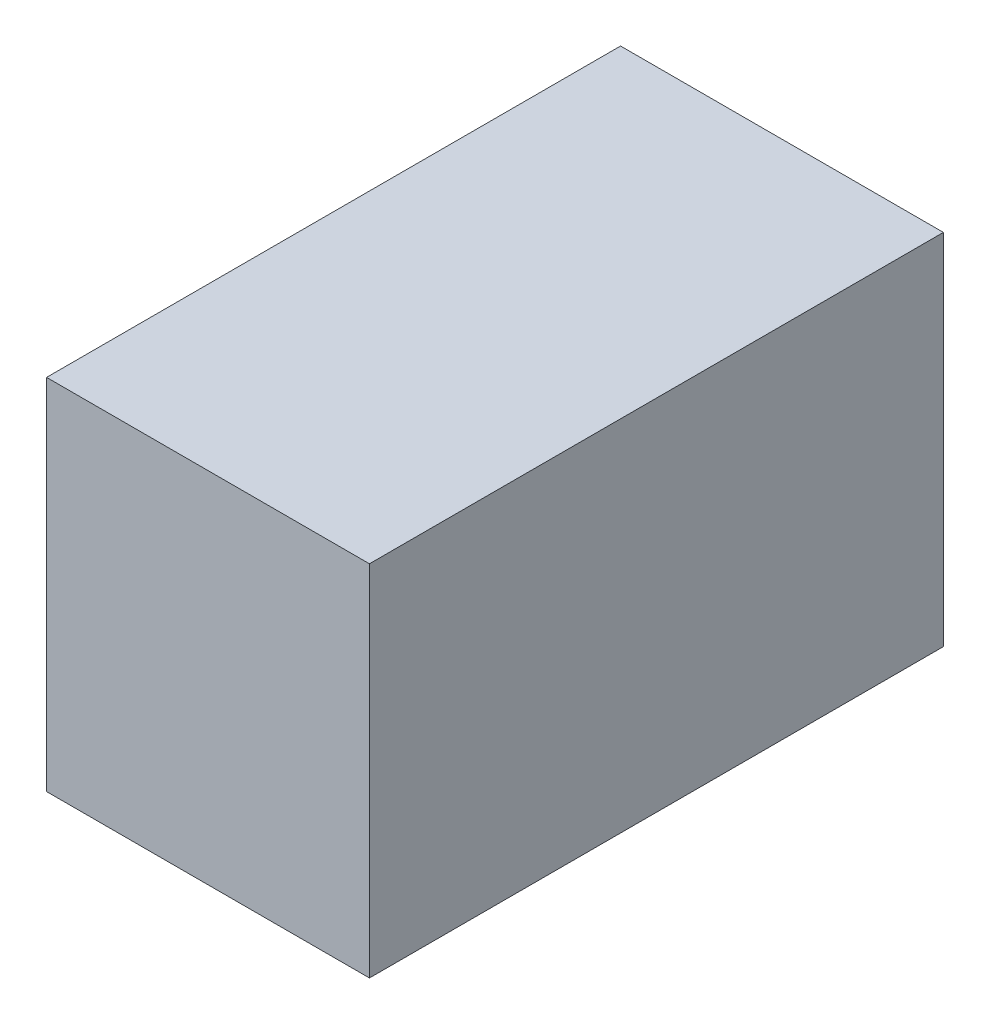
from build123d import *

# Parameters (mm, degrees)
SKETCH1_W           = 45
SKETCH1_H           = 50
BOSS_EXTRUDE1_DEPTH = 80


with BuildPart() as part:
    # Sketch1 → Boss-Extrude1 (new body)
    with BuildSketch(Plane.XY):
        with Locations((22.5, 25)):
            Rectangle(SKETCH1_W, SKETCH1_H)
    extrude(amount=BOSS_EXTRUDE1_DEPTH)


solid = part.part
